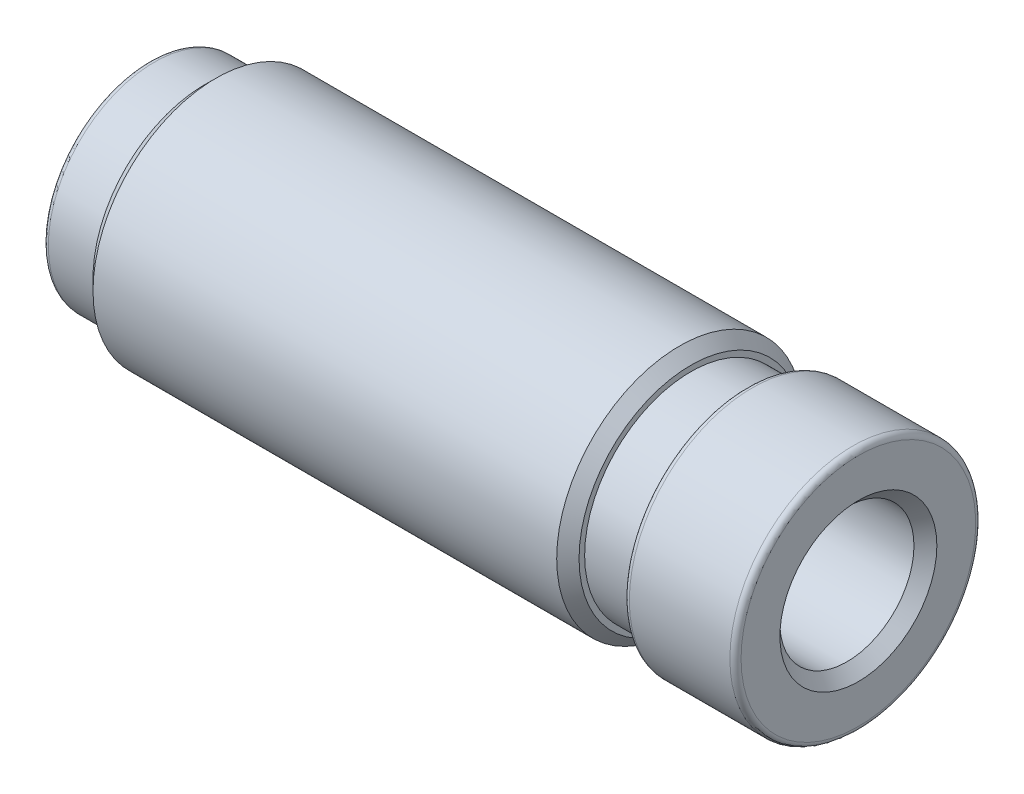
from build123d import *

# Parameters (mm, degrees)
FURO_ROSCADO_DE_M14X2_01_D           = 12
FURO_ROSCADO_DE_M14X2_01_DEPTH       = 53.5
FURO_ROSCADO_DE_M14X2_01_CSINK_D     = 14.05
FURO_ROSCADO_DE_M14X2_01_CSINK_ANGLE = 90
FURO_ROSCADO_DE_M14X2_01_TIP         = 3.605163714
FURO1_D                              = 9.4
FURO1_DEPTH                          = 10
CHANFRO1_SIZE                        = 1
FILETE1_R                            = 0.5


with BuildPart() as part:
    # Esboço1 → Revolução1 (revolve)
    with BuildSketch(Plane.XY, mode=Mode.PRIVATE) as revolu_o1_sk:
        Polygon((0, 0), (63.5, 0), (63.5, 11), (53.5, 11), (53.5, 9.5), (48.5, 9.5), (48.5, 11), (5, 11), (5, 9.5), (0, 9.5), align=None)
    revolve(revolu_o1_sk.sketch.rotate(Axis((0, 0, 0), (1, 0, 0)), 90), axis=Axis((0, 0, 0), (1, 0, 0)))

    # Furo roscado de M14x2.01
    with Locations(Plane(origin=(63.5, 0, 0), x_dir=(0, 0, -1), z_dir=(1, 0, 0))):
        with Locations((0, 0)):
            CounterSinkHole(FURO_ROSCADO_DE_M14X2_01_D / 2, FURO_ROSCADO_DE_M14X2_01_CSINK_D / 2, depth=FURO_ROSCADO_DE_M14X2_01_DEPTH, counter_sink_angle=FURO_ROSCADO_DE_M14X2_01_CSINK_ANGLE)
            with Locations((0, 0, -(FURO_ROSCADO_DE_M14X2_01_DEPTH + FURO_ROSCADO_DE_M14X2_01_TIP / 2))):  # 118° drill point
                Cone(0, FURO_ROSCADO_DE_M14X2_01_D / 2, FURO_ROSCADO_DE_M14X2_01_TIP, mode=Mode.SUBTRACT)

    # Furo1
    with Locations(Plane.ZY):
        with Locations((0, 0)):
            Hole(FURO1_D / 2, depth=FURO1_DEPTH)

    # Chanfro1
    chanfro1_edges = [part.edges().sort_by_distance(p)[0] for p in [
        (5, 0, -11),
        (48.5, 0, -11),
    ]]
    chamfer(chanfro1_edges, length=CHANFRO1_SIZE)

    # Filete1
    filete1_edges = [part.edges().sort_by_distance(p)[0] for p in [
        (63.5, 0, -11),
        (0, 0, 4.7),
        (0, 0, -9.5),
        (53.5, 0, -11),
    ]]
    fillet(filete1_edges, radius=FILETE1_R)


solid = part.part
